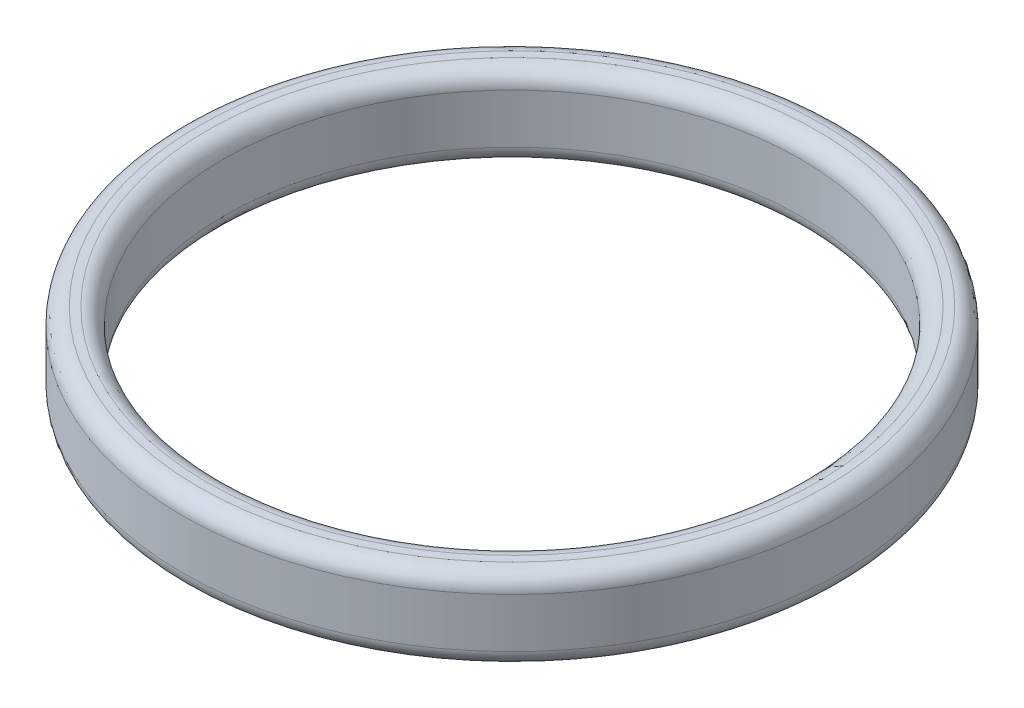
from build123d import *

# Parameters (mm, degrees)
SKETCH1_R           = 4
SKETCH1_R_2         = 3.5
BOSS_EXTRUDE1_DEPTH = 1
FILLET1_R           = 0.2


with BuildPart() as part:
    # Sketch1 → Boss-Extrude1 (new body)
    with BuildSketch(Plane(origin=(0, 0, 0), x_dir=(1, 0, 0), z_dir=(0, 1, 0))):
        with Locations(Location((0, 0, 0), (0, 0, 270))):
            Circle(SKETCH1_R)
        with Locations(Location((0, 0, 0), (0, 0, 270))):
            Circle(SKETCH1_R_2, mode=Mode.SUBTRACT)
    extrude(amount=BOSS_EXTRUDE1_DEPTH)

    # Fillet1
    fillet1_edges = [part.edges().sort_by_distance(p)[0] for p in [
        (0, 0, -4),
        (0, 1, -4),
        (0, 0, -3.5),
        (0, 1, -3.5),
    ]]
    fillet(fillet1_edges, radius=FILLET1_R)


solid = part.part
